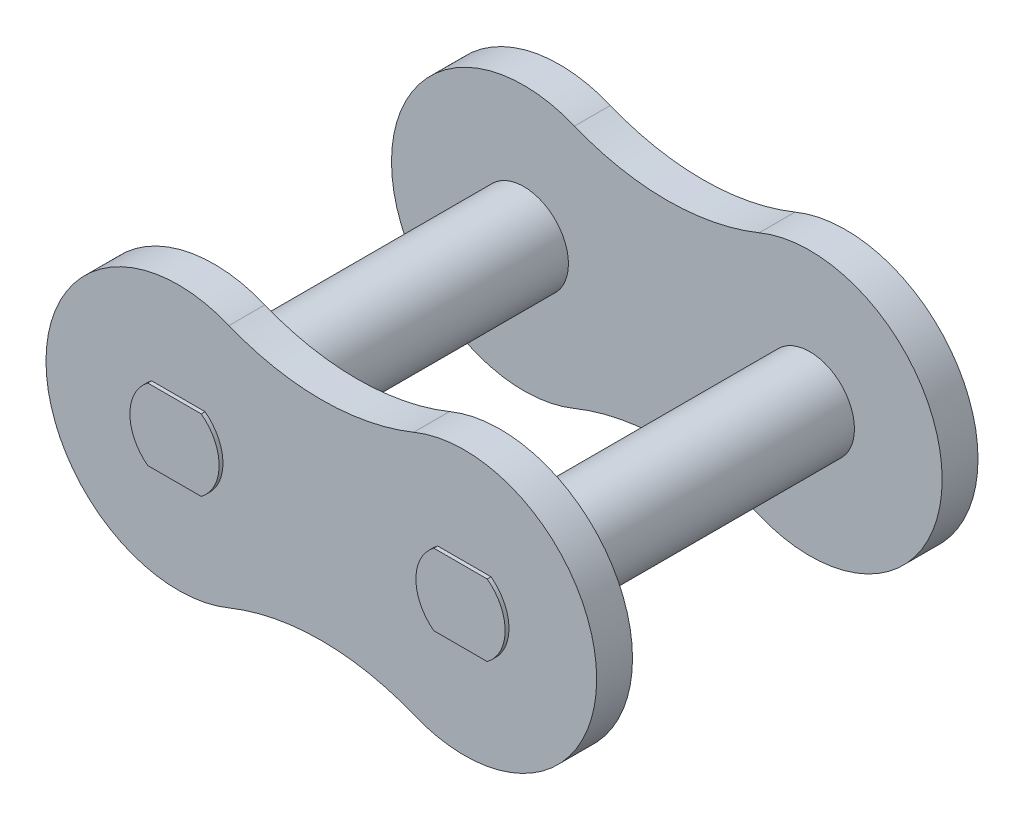
from build123d import *

# Parameters (mm, degrees)
SKETCH1_R           = 2.9718
BOSS_EXTRUDE1_DEPTH = 2.3876
SKETCH2_R           = 2.9718
BOSS_EXTRUDE2_DEPTH = 25.4
BOSS_EXTRUDE3_START = -2.3876
BOSS_EXTRUDE3_DEPTH = 2.3876
BOSS_EXTRUDE4_DEPTH = 0.254


with BuildPart() as part:
    # Sketch1 → Boss-Extrude1 (new body)
    # profile 1 of 12: a face of its own
    with BuildSketch(Plane.XY):
        with BuildLine():
            Line((-5.1181, 4.4069), (-9.525, 8.8138))
            ThreePointArc((-9.525, 8.8138), (-18.169445304, -1.71948708), (-6.152104764, -8.142889424))
            ThreePointArc((-6.152104764, -8.142889424), (-2.196593131, -4.89668492), (-0.7112, 0))
            Line((-0.7112, 0), (-5.1181, 4.4069))
        make_face()
        with Locations((-9.525, 0)):
            Circle(SKETCH1_R, mode=Mode.SUBTRACT)
    # profile 2 of 12: a face of its own
    with BuildSketch(Plane.XY):
        with BuildLine():
            ThreePointArc((-6.152104764, 8.142889424), (-7.80551292, 8.644445304), (-9.525, 8.8138))
            Line((-9.525, 8.8138), (-5.1181, 4.4069))
            Line((-5.1181, 4.4069), (-3.292702252, 6.232297748))
            ThreePointArc((-3.292702252, 6.232297748), (-4.62831508, 7.328406869), (-6.152104764, 8.142889424))
        make_face()
    # profile 3 of 12: a face of its own
    with BuildSketch(Plane.XY):
        with BuildLine():
            Line((-3.292702252, 6.232297748), (-5.1181, 4.4069))
            Line((-5.1181, 4.4069), (-0.7112, 0))
            ThreePointArc((-0.7112, 0), (-1.382110576, 3.372895236), (-3.292702252, 6.232297748))
        make_face()
    # profile 4 of 12: a face of its own
    with BuildSketch(Plane.XY):
        with BuildLine():
            ThreePointArc((-3.292702252, 6.232297748), (-1.382110576, 3.372895236), (-0.7112, 0))
            Line((-0.7112, 0), (0.7112, 0))
            ThreePointArc((0.7112, 0), (1.382110576, 3.372895236), (3.292702252, 6.232297748))
            Line((3.292702252, 6.232297748), (0, 6.232297748))
            Line((0, 6.232297748), (-3.292702252, 6.232297748))
        make_face()
    # profile 5 of 12: a face of its own
    with BuildSketch(Plane.XY):
        with BuildLine():
            ThreePointArc((-0.7112, 0), (-2.196593131, -4.89668492), (-6.152104764, -8.142889424))
            ThreePointArc((-6.152104764, -8.142889424), (0, -6.944339829), (6.152104764, -8.142889424))
            ThreePointArc((6.152104764, -8.142889424), (2.196593131, -4.89668492), (0.7112, 0))
            Line((0.7112, 0), (-0.7112, 0))
        make_face()
    # profile 6 of 12: a face of its own
    with BuildSketch(Plane.XY):
        with BuildLine():
            ThreePointArc((18.3388, 0), (15.757297748, 6.232297748), (9.525, 8.8138))
            Line((9.525, 8.8138), (5.1181, 4.4069))
            Line((5.1181, 4.4069), (0.7112, 0))
            ThreePointArc((0.7112, 0), (2.196593131, -4.89668492), (6.152104764, -8.142889424))
            ThreePointArc((6.152104764, -8.142889424), (14.42168492, -7.328406869), (18.3388, 0))
        make_face()
        with Locations((9.525, 0)):
            Circle(SKETCH1_R, mode=Mode.SUBTRACT)
    # profile 7 of 12: a face of its own
    with BuildSketch(Plane.XY):
        with BuildLine():
            Line((5.1181, 4.4069), (9.525, 8.8138))
            ThreePointArc((9.525, 8.8138), (7.80551292, 8.644445304), (6.152104764, 8.142889424))
            ThreePointArc((6.152104764, 8.142889424), (4.62831508, 7.328406869), (3.292702252, 6.232297748))
            Line((3.292702252, 6.232297748), (5.1181, 4.4069))
        make_face()
    # profile 8 of 12: a face of its own
    with BuildSketch(Plane.XY):
        with BuildLine():
            Line((0.7112, 0), (5.1181, 4.4069))
            Line((5.1181, 4.4069), (3.292702252, 6.232297748))
            ThreePointArc((3.292702252, 6.232297748), (1.382110576, 3.372895236), (0.7112, 0))
        make_face()
    # profile 9 of 12: a face of its own
    with BuildSketch(Plane.XY):
        with BuildLine():
            Line((5.1181, 4.4069), (9.525, 8.8138))
            ThreePointArc((9.525, 8.8138), (7.80551292, 8.644445304), (6.152104764, 8.142889424))
            ThreePointArc((6.152104764, 8.142889424), (4.62831508, 7.328406869), (3.292702252, 6.232297748))
            Line((3.292702252, 6.232297748), (5.1181, 4.4069))
        make_face()
    # profile 10 of 12: a face of its own
    with BuildSketch(Plane.XY):
        with BuildLine():
            ThreePointArc((6.152104764, 8.142889424), (3.133883938, 7.246767675), (0, 6.944339829))
            Line((0, 6.944339829), (0, 6.232297748))
            Line((0, 6.232297748), (3.292702252, 6.232297748))
            ThreePointArc((3.292702252, 6.232297748), (4.62831508, 7.328406869), (6.152104764, 8.142889424))
        make_face()
    # profile 11 of 12: a face of its own
    with BuildSketch(Plane.XY):
        with BuildLine():
            ThreePointArc((0, 6.944339829), (-3.133883938, 7.246767675), (-6.152104764, 8.142889424))
            ThreePointArc((-6.152104764, 8.142889424), (-4.62831508, 7.328406869), (-3.292702252, 6.232297748))
            Line((-3.292702252, 6.232297748), (0, 6.232297748))
            Line((0, 6.232297748), (0, 6.944339829))
        make_face()
    # profile 12 of 12: a face of its own
    with BuildSketch(Plane.XY):
        with BuildLine():
            ThreePointArc((-6.152104764, 8.142889424), (-7.80551292, 8.644445304), (-9.525, 8.8138))
            Line((-9.525, 8.8138), (-5.1181, 4.4069))
            Line((-5.1181, 4.4069), (-3.292702252, 6.232297748))
            ThreePointArc((-3.292702252, 6.232297748), (-4.62831508, 7.328406869), (-6.152104764, 8.142889424))
        make_face()
    extrude(amount=BOSS_EXTRUDE1_DEPTH)

    # Sketch2 → Boss-Extrude2 (add)
    with BuildSketch(Plane(origin=(0, 0, 0), x_dir=(-1, 0, 0), z_dir=(0, 0, -1))):
        with Locations((9.525, 0)):
            Circle(SKETCH2_R)
        with Locations((-9.525, 0)):
            Circle(SKETCH2_R)
    extrude(amount=-BOSS_EXTRUDE2_DEPTH)

    # Sketch3 → Boss-Extrude3 (add)
    with BuildSketch(Plane.XY.offset(25.4).offset(BOSS_EXTRUDE3_START)):
        with BuildLine():
            ThreePointArc((6.152104764, -8.142889424), (18.3388, 0), (6.152104764, 8.142889424))
            ThreePointArc((6.152104764, 8.142889424), (0, 6.944339829), (-6.152104764, 8.142889424))
            ThreePointArc((-6.152104764, 8.142889424), (-18.3388, 0), (-6.152104764, -8.142889424))
            ThreePointArc((-6.152104764, -8.142889424), (0, -6.944339829), (6.152104764, -8.142889424))
        make_face()
    extrude(amount=BOSS_EXTRUDE3_DEPTH)

    # Sketch4 → Boss-Extrude4 (add)
    with BuildSketch(Plane.XY.offset(25.4)):
        with BuildLine():
            Line((-11.302988661, -2.38125), (-7.747011339, -2.38125))
            ThreePointArc((-7.747011339, -2.38125), (-6.868364728, -1.331872467), (-6.5532, 0))
            ThreePointArc((-6.5532, 0), (-6.868364728, 1.331872467), (-7.747011339, 2.38125))
            Line((-7.747011339, 2.38125), (-11.302988661, 2.38125))
            ThreePointArc((-11.302988661, 2.38125), (-12.4968, 0), (-11.302988661, -2.38125))
        make_face()
        with BuildLine():
            ThreePointArc((7.747011339, 2.38125), (6.5532, 0), (7.747011339, -2.38125))
            Line((7.747011339, -2.38125), (11.302988661, -2.38125))
            ThreePointArc((11.302988661, -2.38125), (12.181635272, -1.331872467), (12.4968, 0))
            ThreePointArc((12.4968, 0), (12.181635272, 1.331872467), (11.302988661, 2.38125))
            Line((11.302988661, 2.38125), (7.747011339, 2.38125))
        make_face()
    boss_extrude4 = extrude(amount=BOSS_EXTRUDE4_DEPTH)

    # Mirror1: Boss-Extrude4 across plane
    add(boss_extrude4.mirror(Plane.XY.offset(12.7)))


solid = part.part
